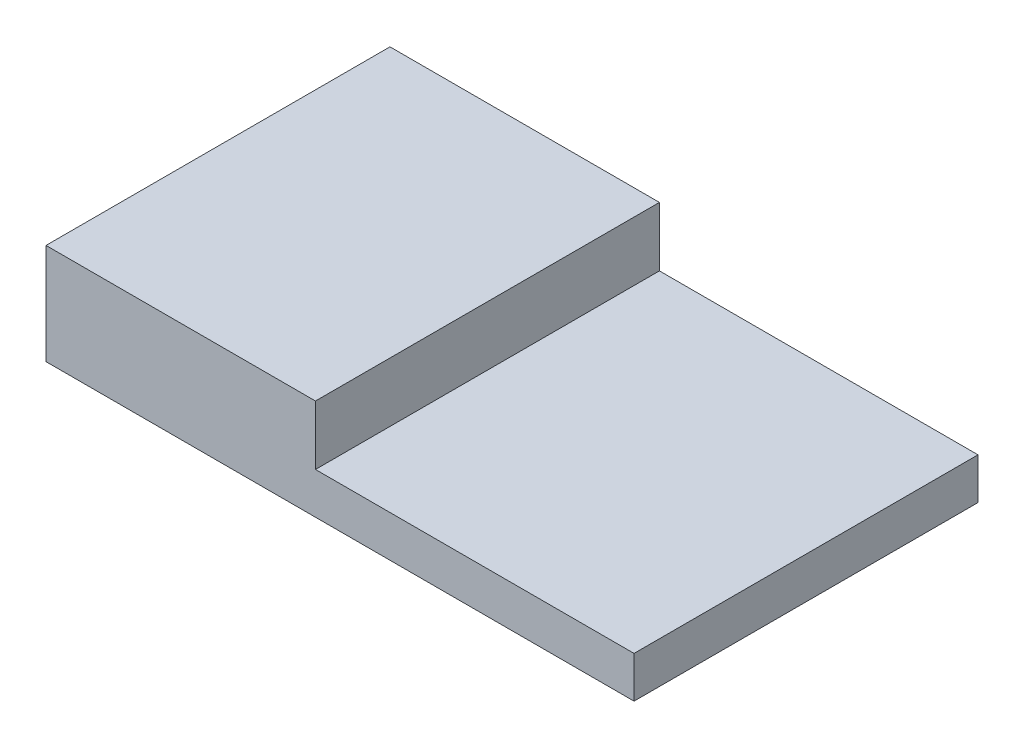
from build123d import *

# Parameters (mm, degrees)
EXTRUDE1_DEPTH = 63.5


with BuildPart() as part:
    # Sketch1 → Extrude1 (new body)
    with BuildSketch(Plane.XY):
        Polygon((0, 18.585731132), (0, 0), (108.558177072, 0), (108.558177072, 7.637971698), (49.745794997, 7.637971698), (49.745794997, 18.585731132), align=None)
    extrude(amount=-EXTRUDE1_DEPTH)


solid = part.part
